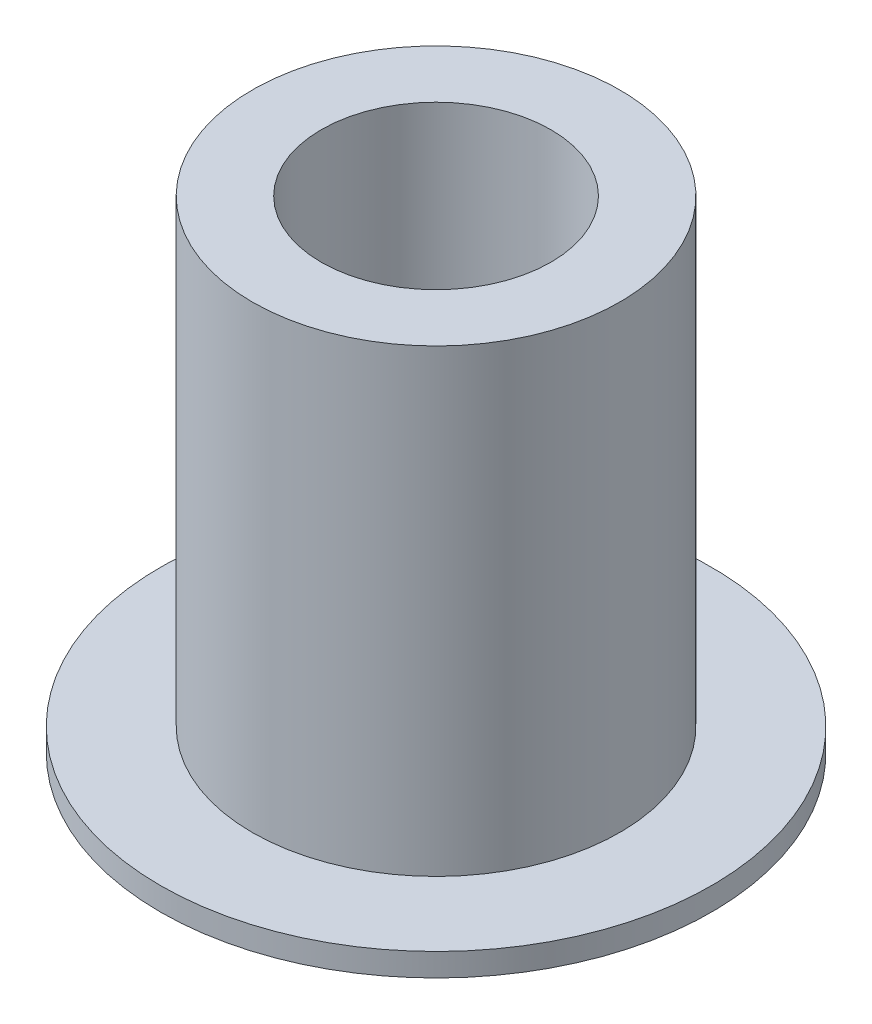
from build123d import *

# Parameters (mm, degrees)
CROQUIS2_R              = 6
SALIENTE_EXTRUIR1_DEPTH = 0.5
CROQUIS3_R              = 4
CROQUIS3_R_2            = 2.5
SALIENTE_EXTRUIR2_DEPTH = 10


with BuildPart() as part:
    # Croquis2 → Saliente-Extruir1 (new body)
    with BuildSketch(Plane(origin=(0, 0, 0), x_dir=(1, 0, 0), z_dir=(0, 1, 0))):
        with Locations(Location((0, 0, 0), (0, 0, 270))):
            Circle(CROQUIS2_R)
    extrude(amount=SALIENTE_EXTRUIR1_DEPTH)

    # Croquis3 → Saliente-Extruir2 (add)
    with BuildSketch(Plane(origin=(0, 0.5, 0), x_dir=(1, 0, 0), z_dir=(0, 1, 0))):
        with Locations(Location((0, 0, 0), (0, 0, 270))):
            Circle(CROQUIS3_R)
        with Locations(Location((0, 0, 0), (0, 0, 270))):
            Circle(CROQUIS3_R_2, mode=Mode.SUBTRACT)
    extrude(amount=SALIENTE_EXTRUIR2_DEPTH)


solid = part.part
